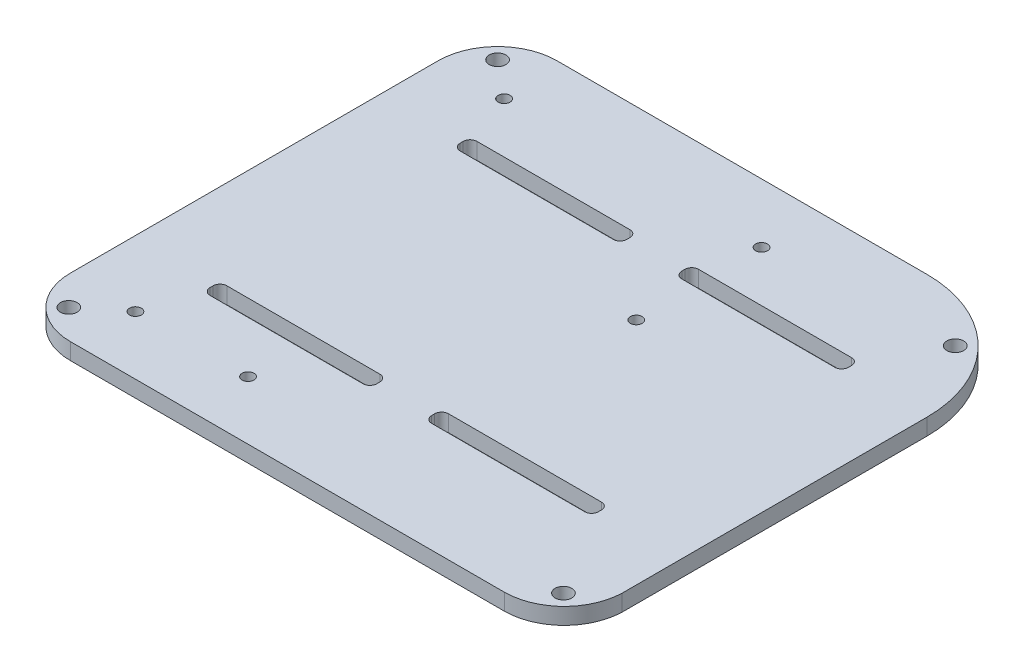
from build123d import *

# Parameters (mm, degrees)
SKETCH1_R           = 1.1
SKETCH1_R_2         = 1.55
BOSS_EXTRUDE1_DEPTH = 3.048


with BuildPart() as part:
    # Sketch1 → Boss-Extrude1 (new body)
    with BuildSketch(Plane(origin=(0, 0, 0), x_dir=(1, 0, 0), z_dir=(0, 1, 0))):
        with BuildLine():
            Line((-40.209744398, 44.711958299), (28.240255602, 44.711958299))
            ThreePointArc((28.240255602, 44.711958299), (44.41885963, 38.010560578), (51.120255602, 21.831955824))
            Line((51.120255602, 21.831955824), (51.120255602, -34.598189146))
            ThreePointArc((51.120255602, -34.598189146), (47.776738906, -42.160841434), (40.130306185, -45.308043388))
            Line((40.130306185, -45.308043388), (-40.209744398, -45.308043388))
            ThreePointArc((-40.209744398, -45.308043388), (-47.987919588, -42.086217385), (-51.209744398, -34.308041701))
            Line((-51.209744398, -34.308041701), (-51.209744398, 33.711958299))
            ThreePointArc((-51.209744398, 33.711958299), (-47.987918991, 41.490132892), (-40.209744398, 44.711958299))
        make_face()
        with Locations(Location((-39.019744398, -34.478043388, 0), (0, 0, 90))):
            Circle(SKETCH1_R, mode=Mode.SUBTRACT)
        with Locations(Location((-18.179744398, -34.478043388, 0), (0, 0, 90))):
            Circle(SKETCH1_R, mode=Mode.SUBTRACT)
        with Locations(Location((-39.019744398, 33.731958299, 0), (0, 0, 90))):
            Circle(SKETCH1_R, mode=Mode.SUBTRACT)
        with Locations(Location((8.610255602, 33.731915189, 0), (0, 0, 90))):
            Circle(SKETCH1_R, mode=Mode.SUBTRACT)
        with Locations(Location((8.655, 10.511958299, 0), (0, 0, 90))):
            Circle(SKETCH1_R, mode=Mode.SUBTRACT)
        with Locations(Location((-45.866598648, 39.368812549, 0), (0, 0, 90))):
            Circle(SKETCH1_R_2, mode=Mode.SUBTRACT)
        with Locations(Location((42.297539172, 35.889240349, 0), (0, 0, 90))):
            Circle(SKETCH1_R_2, mode=Mode.SUBTRACT)
        with Locations(Location((45.695011225, -40.000653974, 0), (0, 0, 90))):
            Circle(SKETCH1_R_2, mode=Mode.SUBTRACT)
        with Locations(Location((-45.858259021, -39.973270185, 0), (0, 0, 90))):
            Circle(SKETCH1_R_2, mode=Mode.SUBTRACT)
        with BuildLine():
            Line((-34.699744398, 24.391958299), (-6.394744398, 24.391958299))
            ThreePointArc((-6.394744398, 24.391958299), (-5.496718786, 24.019983911), (-5.124744398, 23.121958299))
            Line((-5.124744398, 23.121958299), (-5.124744398, 22.561958299))
            ThreePointArc((-5.124744398, 22.561958299), (-5.496718786, 21.663932687), (-6.394744398, 21.291958299))
            Line((-6.394744398, 21.291958299), (-34.699744398, 21.291958299))
            ThreePointArc((-34.699744398, 21.291958299), (-35.59777001, 21.663932687), (-35.969744398, 22.561958299))
            Line((-35.969744398, 22.561958299), (-35.969744398, 23.121958299))
            ThreePointArc((-35.969744398, 23.121958299), (-35.59777001, 24.019983911), (-34.699744398, 24.391958299))
        make_face(mode=Mode.SUBTRACT)
        with BuildLine():
            Line((35.880255602, 23.121958299), (35.880255602, 22.561958299))
            ThreePointArc((35.880255602, 22.561958299), (35.508281214, 21.663932687), (34.610255602, 21.291958299))
            Line((34.610255602, 21.291958299), (6.305255602, 21.291958299))
            ThreePointArc((6.305255602, 21.291958299), (5.40722999, 21.663932687), (5.035255602, 22.561958299))
            Line((5.035255602, 22.561958299), (5.035255602, 23.121958299))
            ThreePointArc((5.035255602, 23.121958299), (5.40722999, 24.019983911), (6.305255602, 24.391958299))
            Line((6.305255602, 24.391958299), (34.610255602, 24.391958299))
            ThreePointArc((34.610255602, 24.391958299), (35.508281214, 24.019983911), (35.880255602, 23.121958299))
        make_face(mode=Mode.SUBTRACT)
        with BuildLine():
            Line((35.880255602, -23.718041701), (35.880255602, -23.158041701))
            ThreePointArc((35.880255602, -23.158041701), (35.508281214, -22.260016089), (34.610255602, -21.888041701))
            Line((34.610255602, -21.888041701), (6.305255602, -21.888041701))
            ThreePointArc((6.305255602, -21.888041701), (5.40722999, -22.260016089), (5.035255602, -23.158041701))
            Line((5.035255602, -23.158041701), (5.035255602, -23.718041701))
            ThreePointArc((5.035255602, -23.718041701), (5.40722999, -24.616067313), (6.305255602, -24.988041701))
            Line((6.305255602, -24.988041701), (34.610255602, -24.988041701))
            ThreePointArc((34.610255602, -24.988041701), (35.508281214, -24.616067313), (35.880255602, -23.718041701))
        make_face(mode=Mode.SUBTRACT)
        with BuildLine():
            Line((-5.124744398, -23.718041701), (-5.124744398, -23.158041701))
            ThreePointArc((-5.124744398, -23.158041701), (-5.496718786, -22.260016089), (-6.394744398, -21.888041701))
            Line((-6.394744398, -21.888041701), (-34.699744398, -21.888041701))
            ThreePointArc((-34.699744398, -21.888041701), (-35.59777001, -22.260016089), (-35.969744398, -23.158041701))
            Line((-35.969744398, -23.158041701), (-35.969744398, -23.718041701))
            ThreePointArc((-35.969744398, -23.718041701), (-35.59777001, -24.616067313), (-34.699744398, -24.988041701))
            Line((-34.699744398, -24.988041701), (-6.394744398, -24.988041701))
            ThreePointArc((-6.394744398, -24.988041701), (-5.496718786, -24.616067313), (-5.124744398, -23.718041701))
        make_face(mode=Mode.SUBTRACT)
    extrude(amount=BOSS_EXTRUDE1_DEPTH)


solid = part.part
